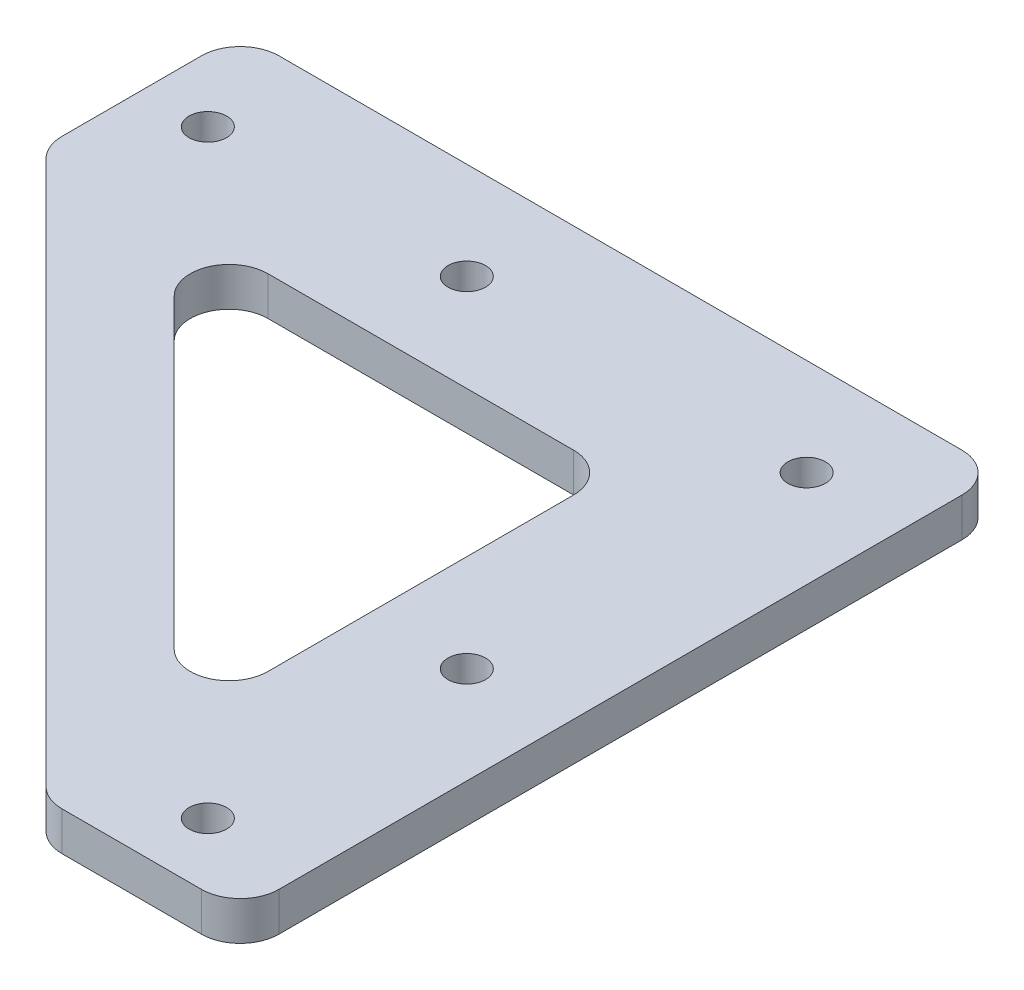
from build123d import *

# Parameters (mm, degrees)
SKETCH_1_R          = 1.45
EXTRUDE_1_DEPTH     = 3
EXTRUDE_2_DEPTH     = 3
SKETCH_4_W          = 43.75
SKETCH_4_H          = 58.75
CUT_EXTRUDE_2_DEPTH = 79.02002948
FILLET_1_R          = 3


with BuildPart() as part:
    # 草图1 → 凸台-拉伸1 (new body)
    with BuildSketch(Plane(origin=(0, 0, 0), x_dir=(1, 0, 0), z_dir=(0, 1, 0))):
        Polygon((-51.25, 0), (0, 0), (51.25, 0), (51.25, -15), (7.5, -15), (7.5, -58.75), (-7.5, -58.75), (-7.5, -15), (-51.25, -15), align=None)
        with Locations(Location((0, -7.5, 0), (0, 0, 270))):
            Circle(SKETCH_1_R, mode=Mode.SUBTRACT)
        with Locations(Location((0, -33.75, 0), (0, 0, 270))):
            Circle(SKETCH_1_R, mode=Mode.SUBTRACT)
        with Locations(Location((0, -53.75, 0), (0, 0, 270))):
            Circle(SKETCH_1_R, mode=Mode.SUBTRACT)
        with Locations(Location((-26.25, -7.5, 0), (0, 0, 270))):
            Circle(SKETCH_1_R, mode=Mode.SUBTRACT)
        with Locations(Location((-46.25, -7.5, 0), (0, 0, 270))):
            Circle(SKETCH_1_R, mode=Mode.SUBTRACT)
        with Locations(Location((46.25, -7.5, 0), (0, 0, 90))):
            Circle(SKETCH_1_R, mode=Mode.SUBTRACT)
        with Locations(Location((26.25, -7.5, 0), (0, 0, 90))):
            Circle(SKETCH_1_R, mode=Mode.SUBTRACT)
    extrude(amount=EXTRUDE_1_DEPTH)

    # 草图2 → 凸台-拉伸2 (add)
    with BuildSketch(Plane(origin=(0, 3, 0), x_dir=(1, 0, 0), z_dir=(0, 1, 0))):
        Polygon((-51.25, -15), (-7.5, -58.75), (-7.5, -48.850505063), (-41.350505063, -15), align=None)
        Polygon((41.350505063, -15), (51.25, -15), (7.5, -58.75), (7.5, -48.850505063), align=None)
    extrude(amount=-EXTRUDE_2_DEPTH)

    # 草图4 → 切除-拉伸2 (cut, through all)
    with BuildSketch(Plane(origin=(0, 3, 0), x_dir=(1, 0, 0), z_dir=(0, 1, 0))):
        with Locations((29.375, -29.375)):
            Rectangle(SKETCH_4_W, SKETCH_4_H)
    extrude(amount=-CUT_EXTRUDE_2_DEPTH, mode=Mode.SUBTRACT)

    # 圆角1
    fillet_1_edges = [part.edges().sort_by_distance(p)[0] for p in [
        (-51.25, 1.5, 0),
        (7.5, 1.5, 58.75),
        (-7.5, 1.5, 58.75),
        (-7.5, 1.5, 15),
        (-51.25, 1.5, 15),
        (-7.5, 1.5, 48.850505063),
        (-41.350505063, 1.5, 15),
        (7.5, 1.5, 0),
    ]]
    fillet(fillet_1_edges, radius=FILLET_1_R)


solid = part.part
